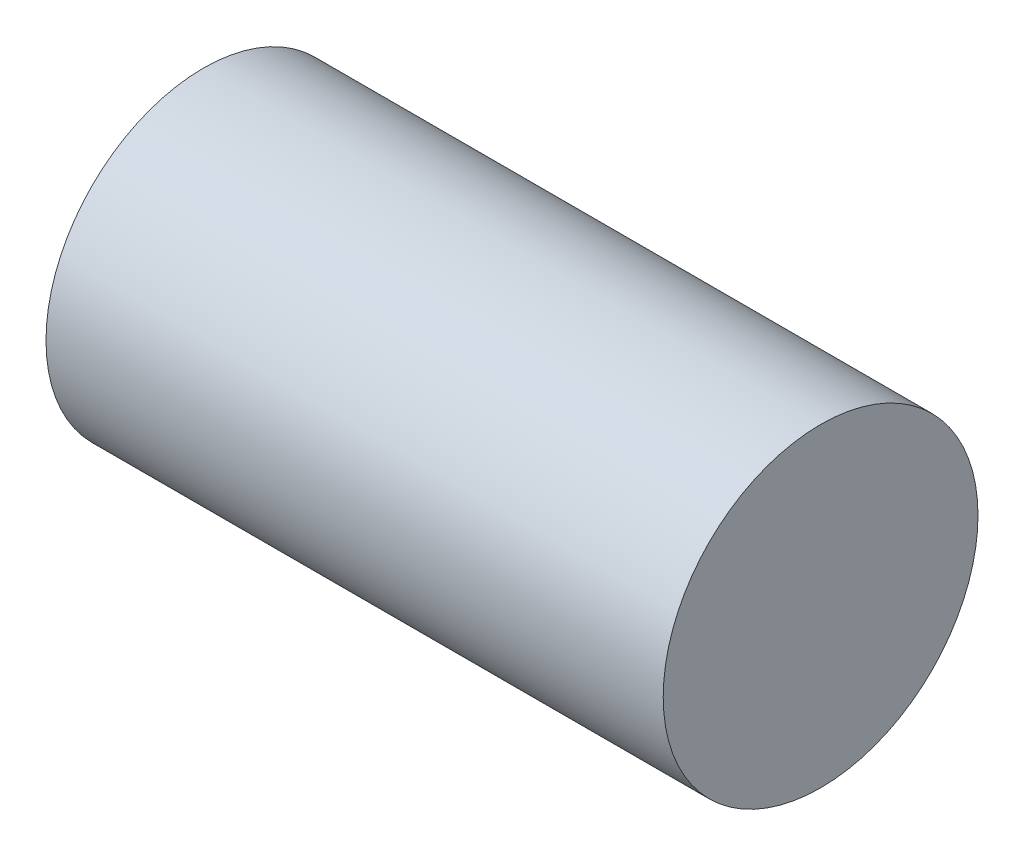
from build123d import *

# Parameters (mm, degrees)
SKETCH1_R           = 6.477
BOSS_EXTRUDE1_DEPTH = 25.4


with BuildPart() as part:
    # Sketch1 → Boss-Extrude1 (new body)
    with BuildSketch(Plane(origin=(0, 0, 0), x_dir=(0, 0, -1), z_dir=(1, 0, 0))):
        Circle(SKETCH1_R)
    extrude(amount=BOSS_EXTRUDE1_DEPTH)


solid = part.part
